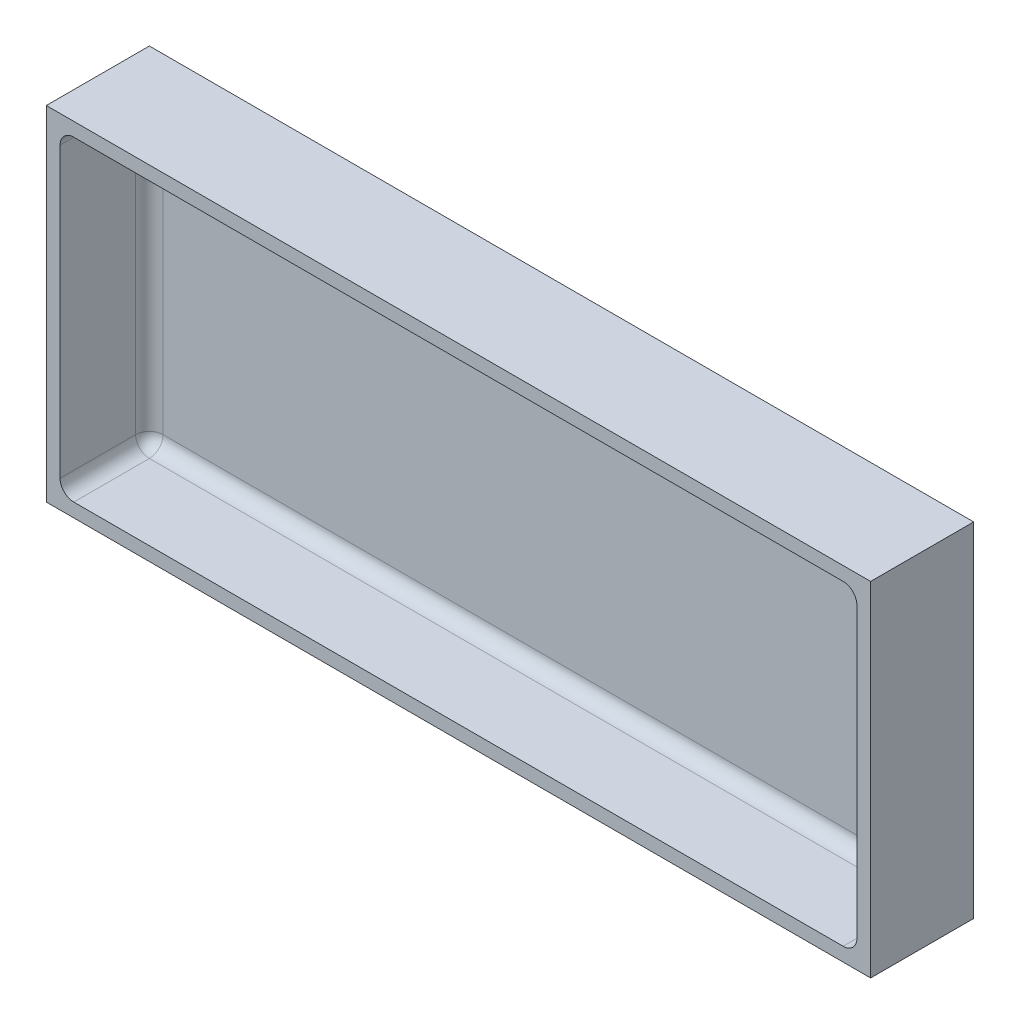
from build123d import *

# Parameters (mm, degrees)
SKETCH1_W           = 120
SKETCH1_H           = 50
BOSS_EXTRUDE1_DEPTH = 15
SHELL1_T            = -2
FILLET1_R           = 2


with BuildPart() as part:
    # Sketch1 → Boss-Extrude1 (new body)
    with BuildSketch(Plane.XY):
        Rectangle(SKETCH1_W, SKETCH1_H)
    extrude(amount=-BOSS_EXTRUDE1_DEPTH)

    # Shell1
    shell1_openings = [part.faces().sort_by_distance(p)[0] for p in [
        (0, 0, 0),
    ]]
    offset(amount=SHELL1_T, openings=shell1_openings, kind=Kind.INTERSECTION)

    # Fillet1
    fillet1_edges = [part.edges().sort_by_distance(p)[0] for p in [
        (58, 0, -13),
        (58, 23, -6.5),
        (0, -23, -13),
        (58, -23, -6.5),
        (-58, 0, -13),
        (-58, -23, -6.5),
        (0, 23, -13),
        (-58, 23, -6.5),
    ]]
    fillet(fillet1_edges, radius=FILLET1_R)


solid = part.part
